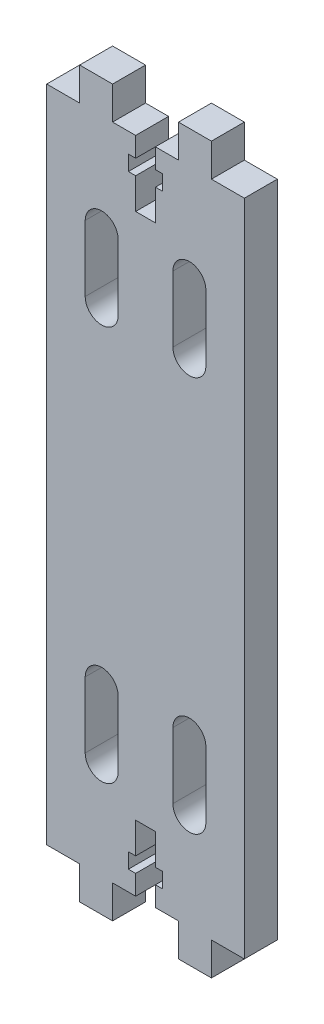
from build123d import *

# Parameters (mm, degrees)
BOSS_EXTRUDE1_DEPTH = 5


with BuildPart() as part:
    # Sketch1 → Boss-Extrude1 (new body)
    with BuildSketch(Plane.XY):
        Polygon((-10, 50), (-15, 50), (-15, -50), (-10, -50), (-10, -55), (-5, -55), (-5, -50), (-1.5, -50), (-1.5, -47), (-2.6, -47), (-2.6, -44.7), (-1.5, -44.7), (-1.5, -40), (1.5, -40), (1.5, -44.7), (2.6, -44.7), (2.6, -47), (1.5, -47), (1.5, -50), (5, -50), (5, -55), (10, -55), (10, -50), (15, -50), (15, 50), (10, 50), (10, 55), (5, 55), (5, 50), (1.5, 50), (1.5, 47), (2.6, 47), (2.6, 44.7), (1.5, 44.7), (1.5, 40), (-1.5, 40), (-1.5, 44.7), (-2.6, 44.7), (-2.6, 47), (-1.5, 47), (-1.5, 50), (-5, 50), (-5, 55), (-10, 55), align=None)
        with BuildLine():
            ThreePointArc((-4.156470727, -35), (-6.656470727, -37.5), (-9.156470727, -35))
            Line((-9.156470727, -35), (-9.156470727, -25))
            ThreePointArc((-9.156470727, -25), (-6.656470727, -22.5), (-4.156470727, -25))
            Line((-4.156470727, -25), (-4.156470727, -35))
        make_face(mode=Mode.SUBTRACT)
        with BuildLine():
            Line((9.156470727, -25), (9.156470727, -35))
            ThreePointArc((9.156470727, -35), (6.656470727, -37.5), (4.156470727, -35))
            Line((4.156470727, -35), (4.156470727, -25))
            ThreePointArc((4.156470727, -25), (6.656470727, -22.5), (9.156470727, -25))
        make_face(mode=Mode.SUBTRACT)
        with BuildLine():
            Line((-9.156470727, 25), (-9.156470727, 35))
            ThreePointArc((-9.156470727, 35), (-6.656470727, 37.5), (-4.156470727, 35))
            Line((-4.156470727, 35), (-4.156470727, 25))
            ThreePointArc((-4.156470727, 25), (-6.656470727, 22.5), (-9.156470727, 25))
        make_face(mode=Mode.SUBTRACT)
        with BuildLine():
            ThreePointArc((4.156470727, 35), (6.656470727, 37.5), (9.156470727, 35))
            Line((9.156470727, 35), (9.156470727, 25))
            ThreePointArc((9.156470727, 25), (6.656470727, 22.5), (4.156470727, 25))
            Line((4.156470727, 25), (4.156470727, 35))
        make_face(mode=Mode.SUBTRACT)
    extrude(amount=BOSS_EXTRUDE1_DEPTH)


solid = part.part
